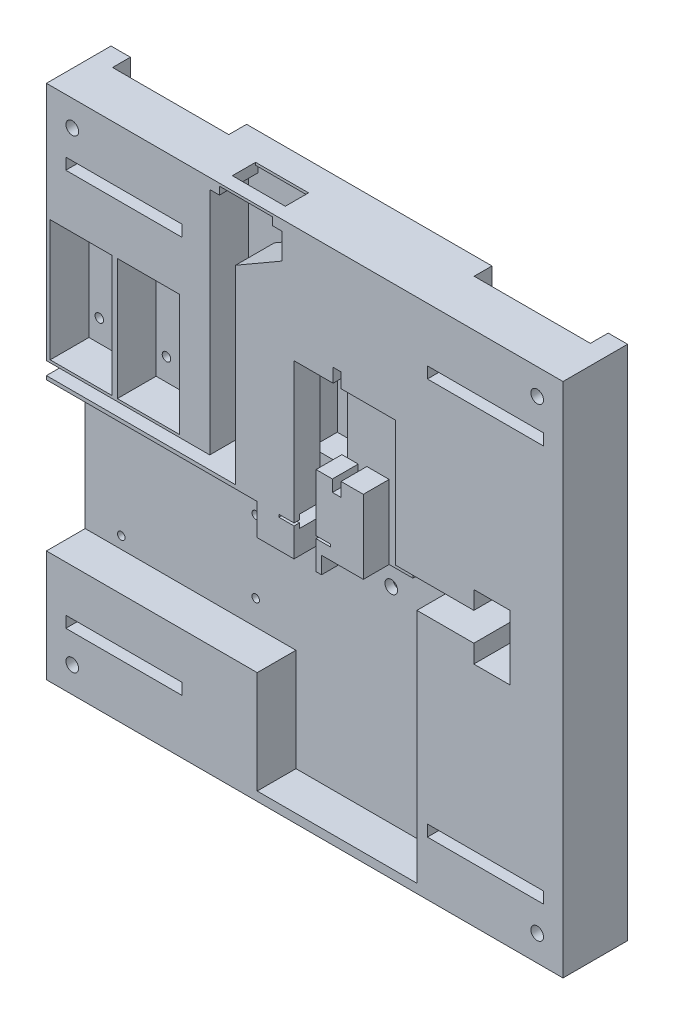
from build123d import *

# Parameters (mm, degrees)
ESBO_O1_W                   = 200
ESBO_O1_H                   = 200
ESBO_O1_W_2                 = 20
ESBO_O1_H_2                 = 1
RESSALTO_EXTRUS_O1_DEPTH    = 25
CORTE_EXTRUS_O1_DEPTH       = 22.5
CORTE_EXTRUS_O2_DEPTH       = 22.5
SERVO_DEPTH                 = 10
ESBO_O9_W                   = 13.932588029
ESBO_O9_H                   = 29.3511916
CURSO_SERVO_DEPTH           = 10
ESBO_O10_W                  = 43
ESBO_O10_H                  = 11
MICROMOTOR_DEPTH            = 20
ESBO_O11_W                  = 14
ESBO_O11_H                  = 25
EXCENTRICA_DEPTH            = 24
ARDUINO_PROTOBOARD_DEPTH    = 15
ESBO_O13_R                  = 2.45
FURO_TAMPA_DEPTH            = 5
ESBO_O18_R                  = 0.75
FIXACAO_MICROMOTOR_DEPTH    = 4
ESBO_O19_R                  = 1.45
FIXACAO_ARDUINO_DEPTH       = 8
ESBO_O20_R                  = 2.45
FIXACAO_CANTONEIRAS_DEPTH   = 12
ESBO_O27_W                  = 41
ESBO_O27_H                  = 16
CORTE_EXTRUS_O5_DEPTH       = 3
ESBO_O28_R                  = 2.45
CORTE_EXTRUS_O6_DEPTH       = 6
ESBO_O30_W                  = 24
ESBO_O30_H                  = 47
CORTE_EXTRUS_O7_DEPTH       = 15
ESBO_O31_R                  = 1.65
CORTE_EXTRUS_O8_DEPTH       = 4
CORTE_EXTRUS_O9_DEPTH       = 15
ESBO_O33_W                  = 20.5
ESBO_O33_H                  = 9
CORTE_EXTRUS_O10_DEPTH      = 2
ESBO_O34_R                  = 1.45
CORTE_EXTRUS_O11_DEPTH      = 6
CORTE_EXTRUS_O12_DEPTH      = 284.240180765
CORTE_EXTRUS_O12_DEPTH_BACK = 284.240180765
ESBO_O35_W                  = 10
ESBO_O35_H                  = 20


with BuildPart() as part:
    # Esboço1 → Ressalto-extrusão1 (new body)
    with BuildSketch(Plane.XY):
        with Locations((100, 100)):
            Rectangle(ESBO_O1_W, ESBO_O1_H)
        with Locations((100, 100)):
            Rectangle(ESBO_O1_W_2, ESBO_O1_H_2, mode=Mode.SUBTRACT)
    extrude(amount=RESSALTO_EXTRUS_O1_DEPTH)

    # Esboço4 → Corte-extrusão1 (cut, symmetric)
    with BuildSketch(Plane(origin=(100, 0, 0), x_dir=(0, 0, -1), z_dir=(1, 0, 0))):
        Polygon((0, 100.5), (-22.9, 100.5), (-22.9, 102.4), (-1.9, 102.4), (-1.9, 123.4), (0, 123.4), (0, 102.73548656), align=None)
        Polygon((-1.9, 97.6), (-1.9, 76.6), (0, 76.6), (0, 97.26451344), (0, 99.5), (-22.9, 99.5), (-22.9, 97.6), align=None)
    extrude(amount=CORTE_EXTRUS_O1_DEPTH, both=True, mode=Mode.SUBTRACT)

    # Esboço5 → Corte-extrusão2 (cut, symmetric)
    with BuildSketch(Plane(origin=(170, 0, 0), x_dir=(0, 0, -1), z_dir=(1, 0, 0))):
        Polygon((-6.9, 25.4), (-27.9, 25.4), (-27.9, 21), (-6.9, 21), (-6.9, 0), (0, 0), (0, 46.4), (-6.9, 46.4), align=None)
        Polygon((0, 153.6), (0, 200), (-6.9, 200), (-6.9, 179), (-27.9, 179), (-27.9, 174.6), (-6.9, 174.6), (-6.9, 153.6), align=None)
    corte_extrus_o2 = extrude(amount=CORTE_EXTRUS_O2_DEPTH, both=True, mode=Mode.SUBTRACT)

    # Espelhar1: Corte-extrusão2 across plane
    add(corte_extrus_o2.mirror(Plane(origin=(100, 0, 0), x_dir=(0, 0, 1), z_dir=(1, 0, 0))), mode=Mode.SUBTRACT)

    # Esboço8 → servo (cut)
    with BuildSketch(Plane.XY.offset(25)):
        Polygon((110.980690263, 154.919320151), (110.980690263, 160.266928562), (114.060842494, 160.266928562), (114.060842494, 154.622230795), (135.078202028, 154.622230795), (135.078202028, 68.997529756), (122.691896905, 68.997529756), (122.691896905, 123.529889256), (114.060842494, 123.529889256), (114.060842494, 118.166513717), (110.71687482, 118.166513717), (110.71687482, 122.685125004), (104.3919778, 122.685125004), (104.3919778, 84.229007332), (95.862407011, 84.229007332), (95.862407011, 154.919320151), align=None)
    extrude(amount=-SERVO_DEPTH, mode=Mode.SUBTRACT)

    # Esboço9 → curso_servo (cut)
    with BuildSketch(Plane.XY.offset(15)):
        with Locations((99.566294015, 133.980532024)):
            Rectangle(ESBO_O9_W, ESBO_O9_H)
    extrude(amount=-CURSO_SERVO_DEPTH, mode=Mode.SUBTRACT)

    # Esboço10 → micromotor (cut)
    with BuildSketch(Plane.XY.offset(25)):
        with Locations((153.363326363, 100.5)):
            Rectangle(ESBO_O10_W, ESBO_O10_H)
    extrude(amount=-MICROMOTOR_DEPTH, mode=Mode.SUBTRACT)

    # Esboço11 → excentrica (cut)
    with BuildSketch(Plane.XY.offset(25)):
        with Locations((172.476028599, 100.5)):
            Rectangle(ESBO_O11_W, ESBO_O11_H)
    extrude(amount=-EXCENTRICA_DEPTH, mode=Mode.SUBTRACT)

    # Esboço12 → arduino_protoboard (cut)
    with BuildSketch(Plane.XY.offset(25)):
        Polygon((0, 43.19844713), (81.609935226, 43.19844713), (81.609935226, 3.494235751), (143.444593673, 3.494235751), (143.444593673, 95), (106.504941259, 95), (106.504941259, 88.44262421), (81.5, 88.44262421), (81.5, 100.581305866), (0, 100.581305866), align=None)
    extrude(amount=-ARDUINO_PROTOBOARD_DEPTH, mode=Mode.SUBTRACT)

    # Esboço13 → furo_tampa (cut)
    with BuildSketch(Plane.XY.offset(25)):
        with Locations((190, 10)):
            Circle(ESBO_O13_R)
        with Locations((10, 10)):
            Circle(ESBO_O13_R)
        with Locations((190, 190)):
            Circle(ESBO_O13_R)
        with Locations((10, 190)):
            Circle(ESBO_O13_R)
    extrude(amount=-FURO_TAMPA_DEPTH, mode=Mode.SUBTRACT)

    # Esboço18 → fixacao_micromotor (cut)
    with BuildSketch(Plane.XY.offset(5)):
        with Locations((139.449791103, 100.5)):
            Circle(ESBO_O18_R)
    extrude(amount=-FIXACAO_MICROMOTOR_DEPTH, mode=Mode.SUBTRACT)

    # Esboço19 → fixacao_arduino (cut)
    with BuildSketch(Plane.XY.offset(10)):
        with Locations((15.24, 96.019876422)):
            Circle(ESBO_O19_R)
        with Locations((66.04, 80.779876422)):
            Circle(ESBO_O19_R)
        with Locations((66.04, 52.839876422)):
            Circle(ESBO_O19_R)
        with Locations((13.97, 47.759876422)):
            Circle(ESBO_O19_R)
    extrude(amount=-FIXACAO_ARDUINO_DEPTH, mode=Mode.SUBTRACT)

    # Esboço20 → fixacao_cantoneiras (cut)
    with BuildSketch(Plane(origin=(0, 0, 6.9), x_dir=(-1, 0, 0), z_dir=(0, 0, -1))):
        with Locations((-188.5, 194.05)):
            Circle(ESBO_O20_R)
        with Locations((-151.5, 194.05)):
            Circle(ESBO_O20_R)
        with Locations((-188.5, 159.55)):
            Circle(ESBO_O20_R)
        with Locations((-188.5, 40.45)):
            Circle(ESBO_O20_R)
        with Locations((-151.5, 159.55)):
            Circle(ESBO_O20_R)
        with Locations((-48.5, 194.05)):
            Circle(ESBO_O20_R)
        with Locations((-11.5, 194.05)):
            Circle(ESBO_O20_R)
        with Locations((-11.5, 159.55)):
            Circle(ESBO_O20_R)
        with Locations((-48.5, 159.55)):
            Circle(ESBO_O20_R)
        with Locations((-151.5, 40.45)):
            Circle(ESBO_O20_R)
        with Locations((-188.5, 5.95)):
            Circle(ESBO_O20_R)
        with Locations((-151.5, 5.95)):
            Circle(ESBO_O20_R)
        with Locations((-48.5, 40.45)):
            Circle(ESBO_O20_R)
        with Locations((-11.5, 40.45)):
            Circle(ESBO_O20_R)
        with Locations((-11.5, 5.95)):
            Circle(ESBO_O20_R)
        with Locations((-48.5, 5.95)):
            Circle(ESBO_O20_R)
        with Locations((-118.5, 117.05)):
            Circle(ESBO_O20_R)
        with Locations((-81.5, 117.05)):
            Circle(ESBO_O20_R)
        with Locations((-81.5, 82.95)):
            Circle(ESBO_O20_R)
        with Locations((-118.5, 82.95)):
            Circle(ESBO_O20_R)
    extrude(amount=-FIXACAO_CANTONEIRAS_DEPTH, mode=Mode.SUBTRACT)

    # Esboço27 → Corte-extrusão5 (cut)
    with BuildSketch(Plane(origin=(0, 0, 0), x_dir=(-1, 0, 0), z_dir=(0, 0, -1))):
        with Locations((-100, 132.583635158)):
            Rectangle(ESBO_O27_W, ESBO_O27_H)
    extrude(amount=-CORTE_EXTRUS_O5_DEPTH, mode=Mode.SUBTRACT)

    # Esboço28 → Corte-extrusão6 (cut)
    with BuildSketch(Plane(origin=(0, 0, 3), x_dir=(-1, 0, 0), z_dir=(0, 0, -1))):
        with Locations((-84, 136.083635158)):
            Circle(ESBO_O28_R)
        with Locations((-116, 129.083635158)):
            Circle(ESBO_O28_R)
    extrude(amount=-CORTE_EXTRUS_O6_DEPTH, mode=Mode.SUBTRACT)

    # Esboço30 → Corte-extrusão7 (cut)
    with BuildSketch(Plane.XY.offset(25)):
        with Locations((39.460585531, 131.5)):
            Rectangle(ESBO_O30_W, ESBO_O30_H)
        with Locations((13.460585531, 131.5)):
            Rectangle(ESBO_O30_W, ESBO_O30_H)
    extrude(amount=-CORTE_EXTRUS_O7_DEPTH, mode=Mode.SUBTRACT)

    # Esboço31 → Corte-extrusão8 (cut)
    with BuildSketch(Plane.XY.offset(10)):
        with Locations((31.480585531, 116.55)):
            Circle(ESBO_O31_R)
        with Locations((47.622063029, 147.578059809)):
            Circle(ESBO_O31_R)
        with Locations((21.622063029, 147.578059809)):
            Circle(ESBO_O31_R)
        with Locations((5.480585531, 116.55)):
            Circle(ESBO_O31_R)
    extrude(amount=-CORTE_EXTRUS_O8_DEPTH, mode=Mode.SUBTRACT)

    # Esboço32 → Corte-extrusão9 (cut)
    with BuildSketch(Plane.XY.offset(25)):
        Polygon((87.483727756, 199), (87.483727756, 196), (91.233727756, 196), (91.233727756, 187), (91.233727756, 186), (73.233727756, 175.607695155), (73.233727756, 102), (0, 102), (0, 107), (63.233727756, 107), (63.233727756, 174.377058812), (63.233727756, 196), (66.983727756, 196), (66.983727756, 199), align=None)
    extrude(amount=-CORTE_EXTRUS_O9_DEPTH, mode=Mode.SUBTRACT)

    # Esboço33 → Corte-extrusão10 (cut)
    with BuildSketch(Plane(origin=(0, 200, 0), x_dir=(1, 0, 0), z_dir=(0, 1, 0))):
        with Locations((77.233727756, -15.5)):
            Rectangle(ESBO_O33_W, ESBO_O33_H)
    extrude(amount=-CORTE_EXTRUS_O10_DEPTH, mode=Mode.SUBTRACT)

    # Esboço34 → Corte-extrusão11 (cut)
    with BuildSketch(Plane.XY.offset(10)):
        with Locations((76.401173256, 183)):
            Circle(ESBO_O34_R)
    extrude(amount=-CORTE_EXTRUS_O11_DEPTH, mode=Mode.SUBTRACT)

    # Esboço35 → Corte-extrusão12 (cut, two sides: drawn at the far end of the back side and taken through both)
    with BuildSketch(Plane.XY.offset(10).offset(-CORTE_EXTRUS_O12_DEPTH_BACK)):
        with Locations((68.233727756, 151.361736586)):
            Rectangle(ESBO_O35_W, ESBO_O35_H)
    extrude(amount=CORTE_EXTRUS_O12_DEPTH + CORTE_EXTRUS_O12_DEPTH_BACK, mode=Mode.SUBTRACT)


solid = part.part
